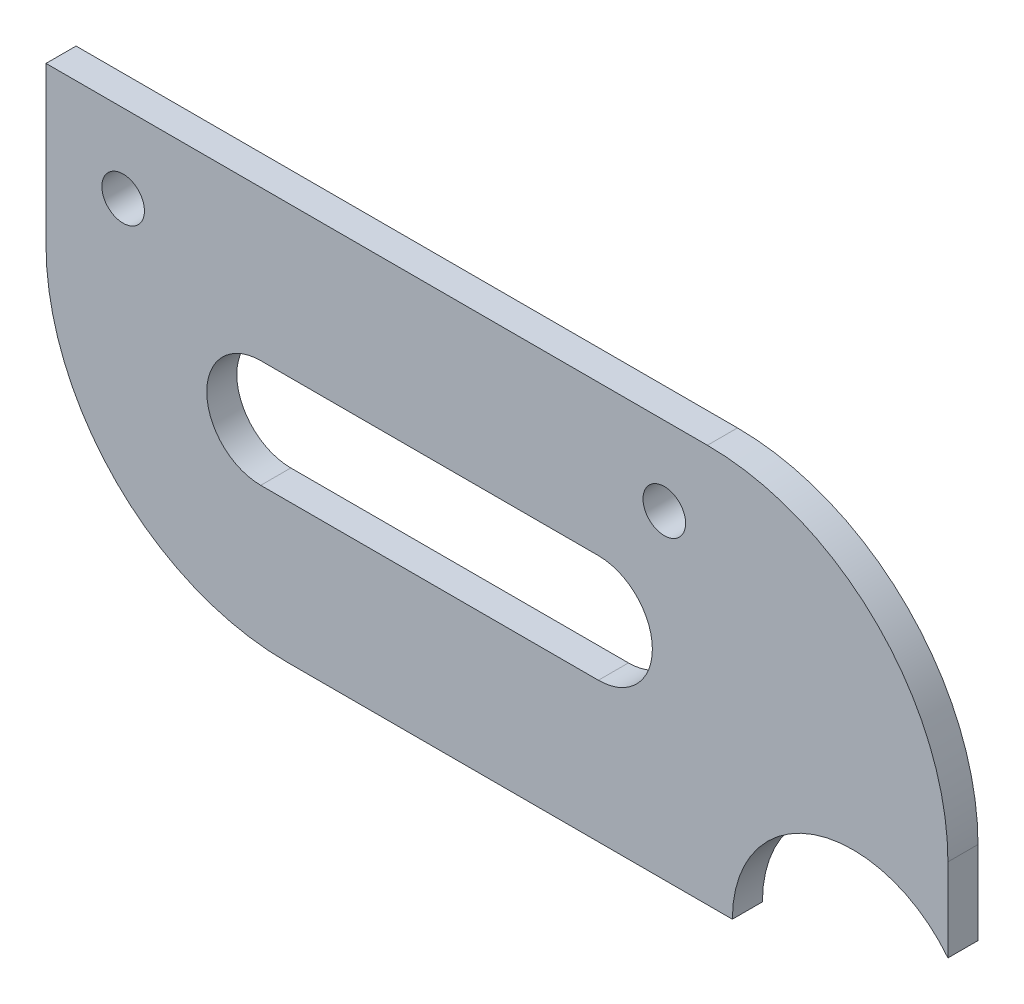
from build123d import *

# Parameters (mm, degrees)
BOSS_EXTRUDE1_DEPTH = 3.175
FILLET1_R           = 25.4
SKETCH2_R           = 2.25
CUT_EXTRUDE1_DEPTH  = 94.20730796


with BuildPart() as part:
    # Sketch1 → Boss-Extrude1 (new body)
    with BuildSketch(Plane.XY):
        with BuildLine():
            Line((-14.497184722, -4.405622253), (80.752815278, -4.405622253))
            Line((80.752815278, -4.405622253), (80.752815278, -38.596437465))
            ThreePointArc((80.752815278, -38.596437465), (66.572735919, -34.398241716), (57.985570414, -46.438178872))
            Line((57.985570414, -46.438178872), (-14.497184722, -46.438178872))
            Line((-14.497184722, -46.438178872), (-14.497184722, -4.405622253))
        make_face()
        with BuildLine():
            Line((8.180129042, -20.254648783), (43.838119696, -20.254648783))
            ThreePointArc((43.838119696, -20.254648783), (49.538039085, -25.954568173), (43.838119696, -31.654487563))
            Line((43.838119696, -31.654487563), (8.180129042, -31.654487563))
            ThreePointArc((8.180129042, -31.654487563), (2.480209652, -25.954568173), (8.180129042, -20.254648783))
        make_face(mode=Mode.SUBTRACT)
    extrude(amount=BOSS_EXTRUDE1_DEPTH)

    # Fillet1
    fillet1_edges = [part.edges().sort_by_distance(p)[0] for p in [
        (80.752815278, -4.405622253, 1.5875),
        (-14.497184722, -46.438178872, 1.5875),
    ]]
    fillet(fillet1_edges, radius=FILLET1_R)

    # Sketch2 → Cut-Extrude1 (cut, through all)
    with BuildSketch(Plane(origin=(0, 0, 0), x_dir=(-1, 0, 0), z_dir=(0, 0, -1))):
        with Locations((-50.8, -12.699000033)):
            Circle(SKETCH2_R)
        with Locations((6.35, -12.699000033)):
            Circle(SKETCH2_R)
    extrude(amount=-CUT_EXTRUDE1_DEPTH, mode=Mode.SUBTRACT)


solid = part.part
